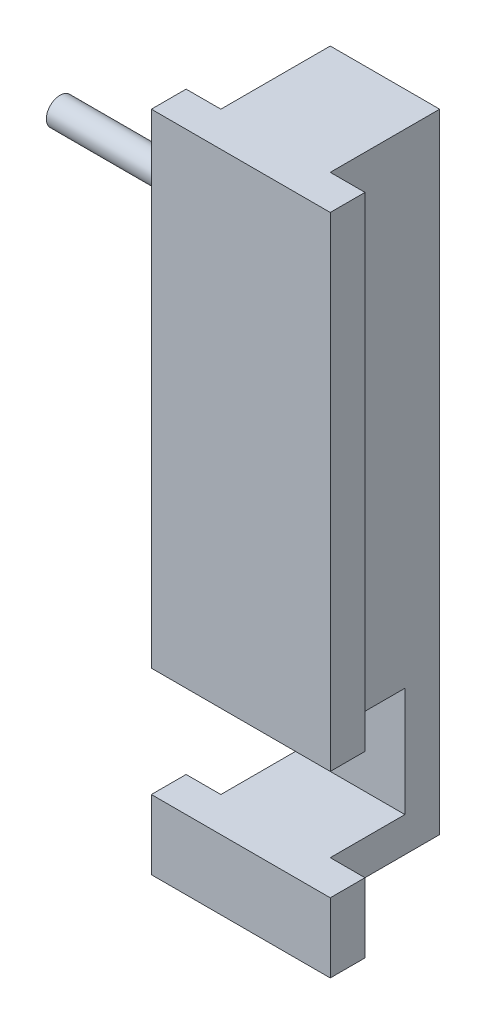
from build123d import *

# Parameters (mm, degrees)
BOSS_EXTRUDE1_DEPTH = 32.7
SKETCH3_W           = 6.35
SKETCH3_H           = 20
CUT_EXTRUDE2_DEPTH  = 129.269452716
SKETCH7_R           = 2.5
BOSS_EXTRUDE4_DEPTH = 33.05


with BuildPart() as part:
    # Sketch2 → Boss-Extrude1 (new body)
    with BuildSketch(Plane(origin=(0, 0, 0), x_dir=(0, 0, -1), z_dir=(1, 0, 0))):
        Polygon((0, 0), (20, 0), (20, -20), (0, -20), (0, -32.7), (6.35, -32.7), (6.35, -26.35), (26.35, -26.35), (26.35, 88.5), (0, 88.5), align=None)
    extrude(amount=BOSS_EXTRUDE1_DEPTH)

    # Sketch3 → Cut-Extrude2 (cut, through all)
    with BuildSketch(Plane(origin=(0, 88.5, 0), x_dir=(1, 0, 0), z_dir=(0, 1, 0))):
        with Locations((3.175, 16.35)):
            Rectangle(SKETCH3_W, SKETCH3_H)
        with Locations((29.525, 16.35)):
            Rectangle(SKETCH3_W, SKETCH3_H)
    extrude(amount=-CUT_EXTRUDE2_DEPTH, mode=Mode.SUBTRACT)

    # Sketch7 → Boss-Extrude4 (add)
    with BuildSketch(Plane.ZY.offset(-6.35)):
        with Locations(Location((-10, 69.86, 0), (0, 0, 180))):
            Circle(SKETCH7_R)
    extrude(amount=BOSS_EXTRUDE4_DEPTH)


solid = part.part
